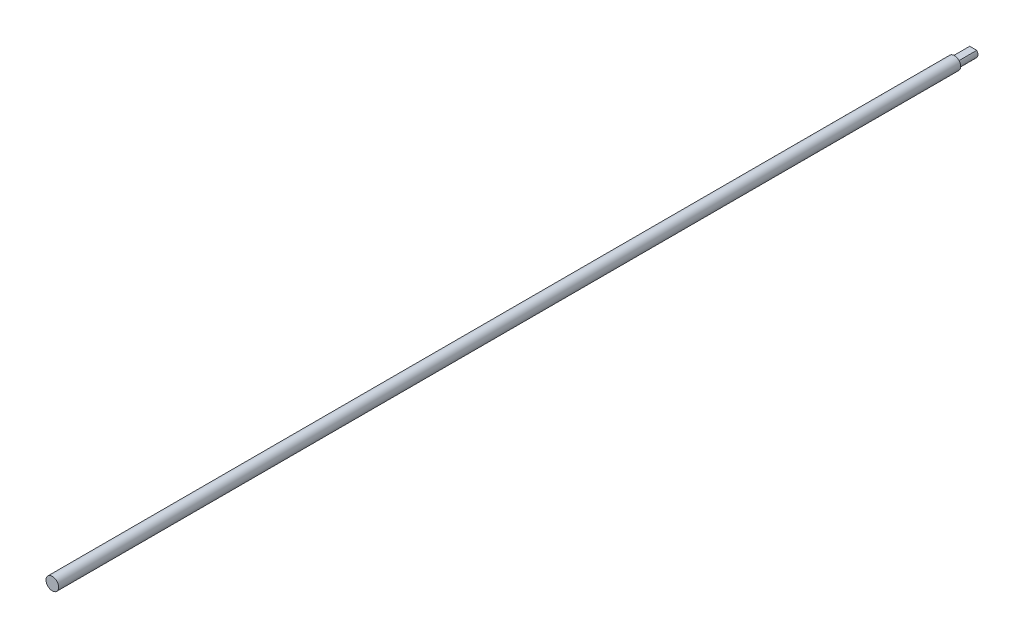
from build123d import *

# Parameters (mm, degrees)
ESBO_O1_R                  = 6.35
RESSALTO_EXTRUS_O1_DEPTH   = 584
ESBO_O2_R                  = 12.7
ESBO_O2_R_2                = 4
CORTE_EXTRUS_O1_DEPTH      = 585.069041296
CORTE_EXTRUS_O2_DEPTH      = 10
CORTE_EXTRUS_O2_DEPTH_BACK = 10
ESBO_O3_W                  = 12
ESBO_O3_H                  = 10
ESBO_O5_W                  = 10
ESBO_O5_H                  = 12


with BuildPart() as part:
    # Esboço1 → Ressalto-extrusão1 (new body)
    with BuildSketch(Plane.XY):
        Circle(ESBO_O1_R)
    extrude(amount=RESSALTO_EXTRUS_O1_DEPTH)

    # Esboço2 → Corte-extrusão1 (cut, through all)
    with BuildSketch(Plane.XY.offset(584)):
        Circle(ESBO_O2_R)
        Circle(ESBO_O2_R_2, mode=Mode.SUBTRACT)
    extrude(amount=-CORTE_EXTRUS_O1_DEPTH, mode=Mode.SUBTRACT)

    # Esboço3 → Corte-extrusão2 (cut, two sides: drawn at the far end of the back side and taken through both)
    with BuildSketch(Plane(origin=(0, 0, 0), x_dir=(0, 0, -1), z_dir=(1, 0, 0)).offset(-CORTE_EXTRUS_O2_DEPTH_BACK)):
        with Locations((-6, 7)):
            Rectangle(ESBO_O3_W, ESBO_O3_H)
    extrude(amount=CORTE_EXTRUS_O2_DEPTH + CORTE_EXTRUS_O2_DEPTH_BACK, mode=Mode.SUBTRACT)

    # Esboço5 → Corte-Revolução2 (revolve, cut)
    with BuildSketch(Plane(origin=(0, 0, 0), x_dir=(1, 0, 0), z_dir=(0, 1, 0))):
        with Locations((-8, -6)):
            Rectangle(ESBO_O5_W, ESBO_O5_H)
    revolve(axis=Axis((0, 0, 0), (0, 0, 1)), mode=Mode.SUBTRACT)


solid = part.part
